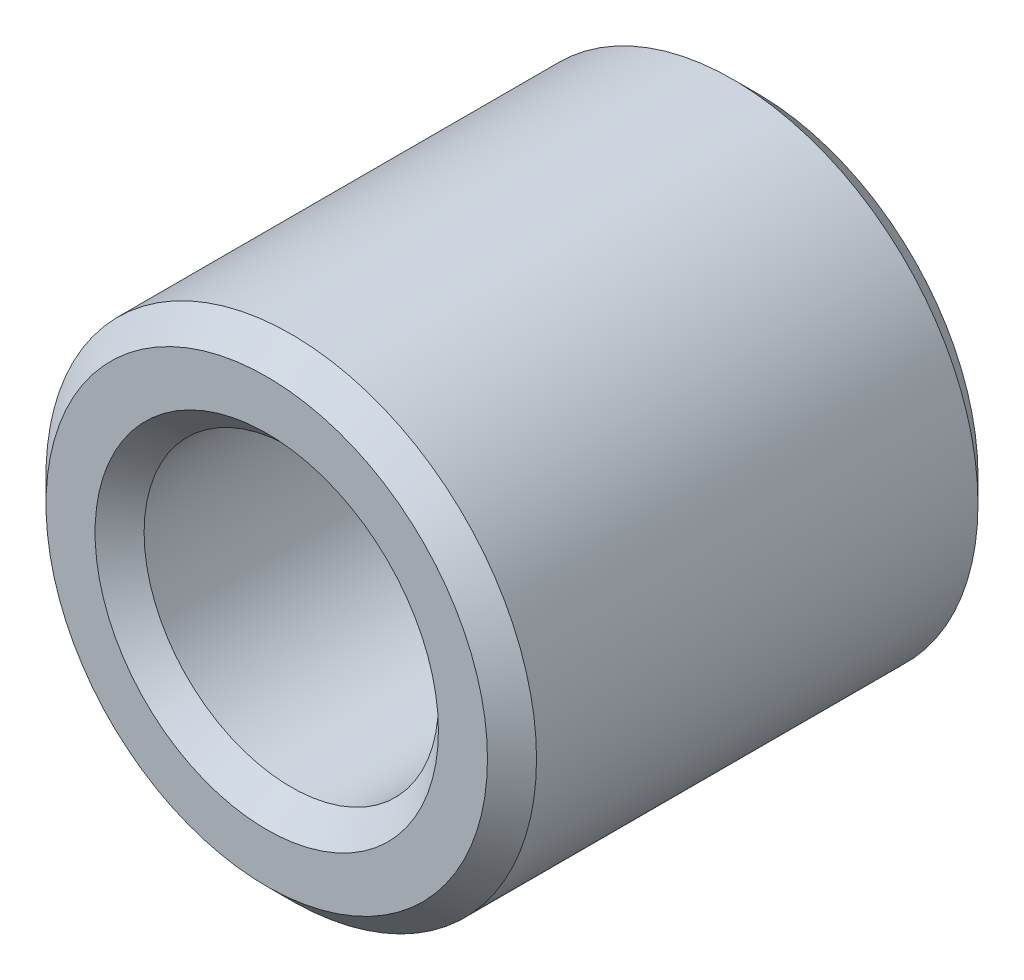
from build123d import *

# Parameters (mm, degrees)
SKETCH1_R           = 5
SKETCH1_R_2         = 3
BOSS_EXTRUDE1_DEPTH = 10
CHAMFER1_SIZE       = 0.5


with BuildPart() as part:
    # Sketch1 → Boss-Extrude1 (new body)
    with BuildSketch(Plane.XY):
        Circle(SKETCH1_R)
        Circle(SKETCH1_R_2, mode=Mode.SUBTRACT)
    extrude(amount=BOSS_EXTRUDE1_DEPTH)

    # Chamfer1
    chamfer1_edges = [part.edges().sort_by_distance(p)[0] for p in [
        (-5, 0, 0),
        (-5, 0, 10),
        (-3, 0, 0),
        (-3, 0, 10),
    ]]
    chamfer(chamfer1_edges, length=CHAMFER1_SIZE)


solid = part.part
